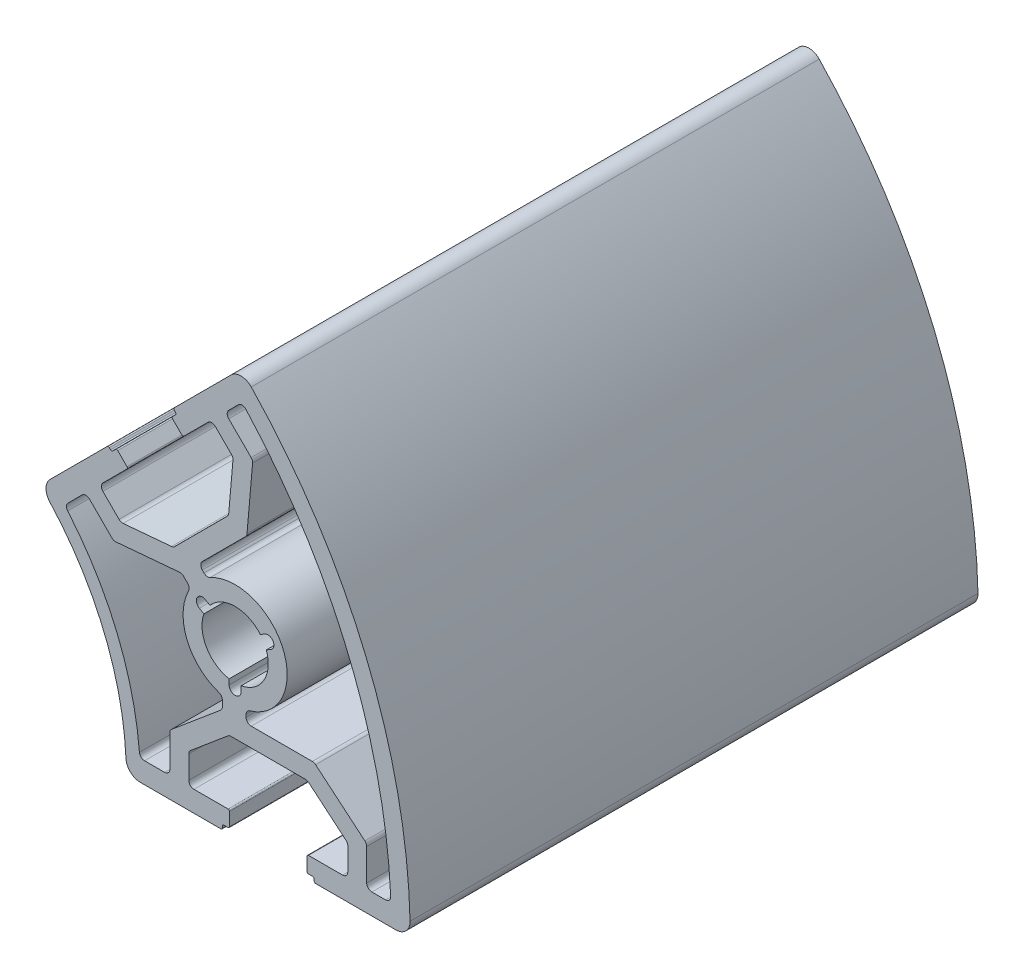
from build123d import *

# Parameters (mm, degrees)
Y_KSEKLIK_EKSTR_ZYON1_DEPTH = 60


with BuildPart() as part:
    # Çizim3 → Yükseklik-Ekstrüzyon1 (new body)
    with BuildSketch(Plane.XY):
        with BuildLine():
            Line((51, 0), (59.481089432, 0))
            ThreePointArc((59.481089432, 0), (60.555036053, 0.452794836), (60.980612695, 1.537815126))
            ThreePointArc((60.980612695, 1.537815126), (56.356651483, 23.343689374), (44.207204261, 42.032405254))
            ThreePointArc((44.207204261, 42.032405254), (43.139050927, 42.498702329), (42.05948169, 42.05948169))
            Line((42.05948169, 42.05948169), (36.062445841, 36.062445841))
            ThreePointArc((36.062445841, 36.062445841), (36.018511858, 35.956379823), (36.062445841, 35.850313806))
            Line((36.062445841, 35.850313806), (36.203867197, 35.70889245))
            ThreePointArc((36.203867197, 35.70889245), (36.24780118, 35.602826433), (36.203867197, 35.496760416))
            Line((36.203867197, 35.496760416), (35.885669145, 35.178562364))
            ThreePointArc((35.885669145, 35.178562364), (35.841735162, 35.072496347), (35.885669145, 34.96643033))
            Line((35.885669145, 34.96643033), (36.875618639, 33.976480836))
            ThreePointArc((36.875618639, 33.976480836), (36.981684656, 33.932546853), (37.087750673, 33.976480836))
            Line((37.087750673, 33.976480836), (39.636467242, 36.525197405))
            ThreePointArc((39.636467242, 36.525197405), (40.022243815, 36.684991294), (40.408020388, 36.525197405))
            Line((40.408020388, 36.525197405), (42.112435937, 34.820781856))
            ThreePointArc((42.112435937, 34.820781856), (42.239327901, 34.621601371), (42.270153765, 34.387455685))
            Line((42.270153765, 34.387455685), (41.822915851, 29.275502936))
            ThreePointArc((41.822915851, 29.275502936), (41.773876207, 29.092484494), (41.665198023, 28.937275961))
            Line((41.665198023, 28.937275961), (36.116547908, 23.388625846))
            ThreePointArc((36.116547908, 23.388625846), (35.961339375, 23.279947662), (35.778320934, 23.230908018))
            Line((35.778320934, 23.230908018), (30.666368185, 22.783670104))
            ThreePointArc((30.666368185, 22.783670104), (30.432222498, 22.814495969), (30.233042013, 22.941387932))
            Line((30.233042013, 22.941387932), (28.528626464, 24.645803481))
            ThreePointArc((28.528626464, 24.645803481), (28.368832576, 25.031580054), (28.528626464, 25.417356627))
            Line((28.528626464, 25.417356627), (31.077343033, 27.966073196))
            ThreePointArc((31.077343033, 27.966073196), (31.121277016, 28.072139213), (31.077343033, 28.17820523))
            Line((31.077343033, 28.17820523), (30.087393539, 29.168154724))
            ThreePointArc((30.087393539, 29.168154724), (29.981327522, 29.212088707), (29.875261505, 29.168154724))
            Line((29.875261505, 29.168154724), (29.557063454, 28.849956672))
            ThreePointArc((29.557063454, 28.849956672), (29.450997436, 28.80602269), (29.344931419, 28.849956672))
            Line((29.344931419, 28.849956672), (29.203510063, 28.991378029))
            ThreePointArc((29.203510063, 28.991378029), (29.097444046, 29.035312011), (28.991378029, 28.991378029))
            Line((28.991378029, 28.991378029), (22.956480566, 22.956480566))
            ThreePointArc((22.956480566, 22.956480566), (22.517540413, 21.930445005), (22.90865732, 20.885244069))
            ThreePointArc((22.90865732, 20.885244069), (28.640265508, 11.863186403), (30.966964646, 1.430769231))
            ThreePointArc((30.966964646, 1.430769231), (31.429471899, 0.415139144), (32.465366161, 0))
            Line((32.465366161, 0), (41, 0))
            ThreePointArc((41, 0), (41.106066017, 0.043933983), (41.15, 0.15))
            Line((41.15, 0.15), (41.15, 0.35))
            ThreePointArc((41.15, 0.35), (41.193933983, 0.456066017), (41.3, 0.5))
            Line((41.3, 0.5), (41.75, 0.5))
            ThreePointArc((41.75, 0.5), (41.856066017, 0.543933983), (41.9, 0.65))
            Line((41.9, 0.65), (41.9, 2.05))
            ThreePointArc((41.9, 2.05), (41.856066017, 2.156066017), (41.75, 2.2))
            Line((41.75, 2.2), (38.145570461, 2.2))
            ThreePointArc((38.145570461, 2.2), (37.759793889, 2.359793889), (37.6, 2.745570461))
            Line((37.6, 2.745570461), (37.6, 5.155978046))
            ThreePointArc((37.6, 5.155978046), (37.651115704, 5.386546086), (37.794884529, 5.573909267))
            Line((37.794884529, 5.573909267), (41.725825944, 8.872360759))
            ThreePointArc((41.725825944, 8.872360759), (41.88991579, 8.967098075), (42.076511877, 9))
            Line((42.076511877, 9), (49.923488123, 9))
            ThreePointArc((49.923488123, 9), (50.11008421, 8.967098075), (50.274174056, 8.872360759))
            Line((50.274174056, 8.872360759), (54.205115471, 5.573909267))
            ThreePointArc((54.205115471, 5.573909267), (54.348884296, 5.386546086), (54.4, 5.155978046))
            Line((54.4, 5.155978046), (54.4, 2.745570461))
            ThreePointArc((54.4, 2.745570461), (54.240206111, 2.359793889), (53.854429539, 2.2))
            Line((53.854429539, 2.2), (50.25, 2.2))
            ThreePointArc((50.25, 2.2), (50.143933983, 2.156066017), (50.1, 2.05))
            Line((50.1, 2.05), (50.1, 0.65))
            ThreePointArc((50.1, 0.65), (50.143933983, 0.543933983), (50.25, 0.5))
            Line((50.25, 0.5), (50.7, 0.5))
            ThreePointArc((50.7, 0.5), (50.806066017, 0.456066017), (50.85, 0.35))
            Line((50.85, 0.35), (50.85, 0.15))
            ThreePointArc((50.85, 0.15), (50.893933983, 0.043933983), (51, 0))
        make_face()
        with BuildLine():
            Line((56.945570461, 2.2), (58.389915016, 2.2))
            ThreePointArc((58.389915016, 2.2), (58.784647482, 2.368962697), (58.934883346, 2.771195588))
            ThreePointArc((58.934883346, 2.771195588), (54.508892418, 22.57832251), (43.632786855, 39.71372447))
            ThreePointArc((43.632786855, 39.71372447), (43.242132452, 39.891913277), (42.843539779, 39.732269942))
            Line((42.843539779, 39.732269942), (41.82223395, 38.710964113))
            ThreePointArc((41.82223395, 38.710964113), (41.662440062, 38.32518754), (41.82223395, 37.939410967))
            Line((41.82223395, 37.939410967), (44.186108114, 35.575536804))
            ThreePointArc((44.186108114, 35.575536804), (44.313000077, 35.376356319), (44.343825942, 35.142210633))
            Line((44.343825942, 35.142210633), (43.751861055, 28.376021015))
            ThreePointArc((43.751861055, 28.376021015), (43.702821411, 28.193002574), (43.594143227, 28.037794041))
            Line((43.594143227, 28.037794041), (39.029162165, 23.472812979))
            ThreePointArc((39.029162165, 23.472812979), (38.869368276, 23.087036406), (39.029162165, 22.701259833))
            Line((39.029162165, 22.701259833), (39.209750843, 22.520671155))
            ThreePointArc((39.209750843, 22.520671155), (39.518169578, 22.366389496), (39.857496647, 22.42788817))
            ThreePointArc((39.857496647, 22.42788817), (47.579795924, 19.708196767), (44.042417973, 12.324594348))
            ThreePointArc((44.042417973, 12.324594348), (43.758991372, 12.128140006), (43.65, 11.800961419))
            Line((43.65, 11.800961419), (43.65, 11.545570461))
            ThreePointArc((43.65, 11.545570461), (43.809793889, 11.159793889), (44.195570461, 11))
            Line((44.195570461, 11), (50.651428591, 11))
            ThreePointArc((50.651428591, 11), (50.838024679, 10.967098075), (51.002114524, 10.872360759))
            Line((51.002114524, 10.872360759), (56.205115471, 6.506524583))
            ThreePointArc((56.205115471, 6.506524583), (56.348884296, 6.319161403), (56.4, 6.088593363))
            Line((56.4, 6.088593363), (56.4, 2.745570461))
            ThreePointArc((56.4, 2.745570461), (56.559793889, 2.359793889), (56.945570461, 2.2))
        make_face(mode=Mode.SUBTRACT)
        with BuildLine():
            Line((35.054429539, 2.2), (32.931315946, 2.2))
            ThreePointArc((32.931315946, 2.2), (32.561912844, 2.344087614), (32.387631786, 2.700242082))
            ThreePointArc((32.387631786, 2.700242082), (30.026084807, 12.437211552), (24.81087355, 20.992154575))
            ThreePointArc((24.81087355, 20.992154575), (24.682269628, 21.367229133), (24.841591738, 21.730321901))
            Line((24.841591738, 21.730321901), (26.342859756, 23.231589919))
            ThreePointArc((26.342859756, 23.231589919), (26.728636329, 23.391383807), (27.114412902, 23.231589919))
            Line((27.114412902, 23.231589919), (29.478287065, 20.867715756))
            ThreePointArc((29.478287065, 20.867715756), (29.67746755, 20.740823792), (29.911613237, 20.709997927))
            Line((29.911613237, 20.709997927), (36.622183037, 21.297096711))
            ThreePointArc((36.622183037, 21.297096711), (36.856328724, 21.266270846), (37.055509209, 21.139378882))
            Line((37.055509209, 21.139378882), (37.485300638, 20.709587454))
            ThreePointArc((37.485300638, 20.709587454), (37.638184329, 20.410368657), (37.586740146, 20.07831624))
            ThreePointArc((37.586740146, 20.07831624), (37.417121067, 15.498679011), (40.775352408, 12.380325272))
            ThreePointArc((40.775352408, 12.380325272), (41.046525454, 12.181905286), (41.15, 11.862220551))
            Line((41.15, 11.862220551), (41.15, 11.254403684))
            ThreePointArc((41.15, 11.254403684), (41.098884296, 11.023835644), (40.955115471, 10.836472464))
            Line((40.955115471, 10.836472464), (35.794884529, 6.506524583))
            ThreePointArc((35.794884529, 6.506524583), (35.651115704, 6.319161403), (35.6, 6.088593363))
            Line((35.6, 6.088593363), (35.6, 2.745570461))
            ThreePointArc((35.6, 2.745570461), (35.440206111, 2.359793889), (35.054429539, 2.2))
        make_face(mode=Mode.SUBTRACT)
        with BuildLine():
            Line((45.161707445, 19.874363918), (45.645032532, 20.153411787))
            ThreePointArc((45.645032532, 20.153411787), (46.512534009, 19.920965467), (46.280087689, 19.05346399))
            Line((46.280087689, 19.05346399), (45.796762602, 18.774416121))
            ThreePointArc((45.796762602, 18.774416121), (45.529547409, 15.853437889), (43.133513652, 14.161533627))
            Line((43.133513652, 14.161533627), (43.133513652, 13.603437889))
            ThreePointArc((43.133513652, 13.603437889), (42.498458496, 12.968382732), (41.863403339, 13.603437889))
            Line((41.863403339, 13.603437889), (41.863403339, 14.161533627))
            ThreePointArc((41.863403339, 14.161533627), (39.467369582, 15.853437889), (39.200154389, 18.774416121))
            Line((39.200154389, 18.774416121), (38.716829302, 19.05346399))
            ThreePointArc((38.716829302, 19.05346399), (38.484382982, 19.920965467), (39.351884459, 20.153411787))
            Line((39.351884459, 20.153411787), (39.835209546, 19.874363918))
            ThreePointArc((39.835209546, 19.874363918), (42.498458496, 21.103437889), (45.161707445, 19.874363918))
        make_face(mode=Mode.SUBTRACT)
    extrude(amount=-Y_KSEKLIK_EKSTR_ZYON1_DEPTH)


solid = part.part
